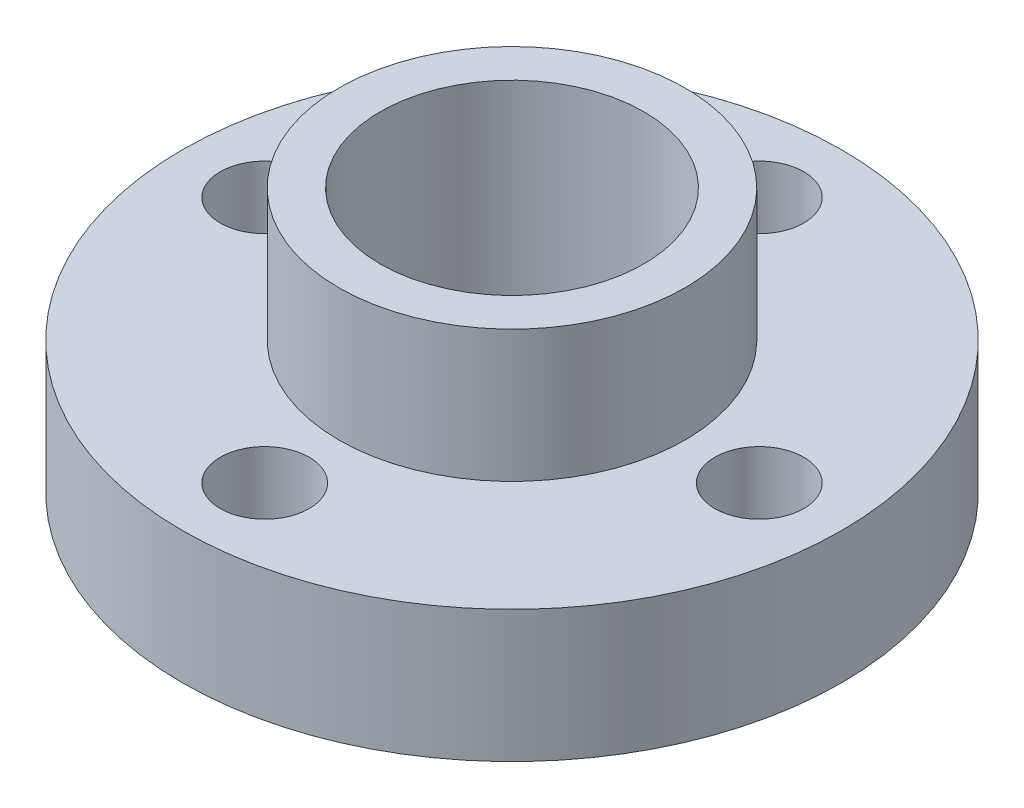
from build123d import *

# Parameters (mm, degrees)
SKETCH1_R           = 10
BOSS_EXTRUDE1_DEPTH = 4
SKETCH2_R           = 5.25
BOSS_EXTRUDE2_DEPTH = 4
SKETCH3_R           = 1.35
CUT_EXTRUDE1_DEPTH  = 15.696938457
SKETCH4_R           = 4
CUT_EXTRUDE2_DEPTH  = 17.248076809


with BuildPart() as part:
    # Sketch1 → Boss-Extrude1 (new body)
    with BuildSketch(Plane(origin=(0, 0, 0), x_dir=(1, 0, 0), z_dir=(0, 1, 0))):
        with Locations(Location((0, 0, 0), (0, 0, 270))):
            Circle(SKETCH1_R)
    extrude(amount=BOSS_EXTRUDE1_DEPTH)

    # Sketch2 → Boss-Extrude2 (add)
    with BuildSketch(Plane(origin=(0, 4, 0), x_dir=(1, 0, 0), z_dir=(0, 1, 0))):
        with Locations(Location((0, 0, 0), (0, 0, 270))):
            Circle(SKETCH2_R)
    extrude(amount=BOSS_EXTRUDE2_DEPTH)

    # Sketch3 → Cut-Extrude1 (cut, through all)
    with BuildSketch(Plane(origin=(0, 4, 0), x_dir=(1, 0, 0), z_dir=(0, 1, 0))):
        with Locations(Location((0, 7.5, 0), (0, 0, 270))):
            Circle(SKETCH3_R)
        with Locations(Location((7.5, 0, 0), (0, 0, 270))):
            Circle(SKETCH3_R)
        with Locations(Location((0, -7.5, 0), (0, 0, 90))):
            Circle(SKETCH3_R)
        with Locations(Location((-7.5, 0, 0), (0, 0, 90))):
            Circle(SKETCH3_R)
    extrude(amount=-CUT_EXTRUDE1_DEPTH, mode=Mode.SUBTRACT)

    # Sketch4 → Cut-Extrude2 (cut, through all)
    with BuildSketch(Plane(origin=(0, 8, 0), x_dir=(-1, 0, 0), z_dir=(0, 1, 0))):
        with Locations(Location((0, 0, 0), (0, 0, 90))):
            Circle(SKETCH4_R)
    extrude(amount=-CUT_EXTRUDE2_DEPTH, mode=Mode.SUBTRACT)


solid = part.part
